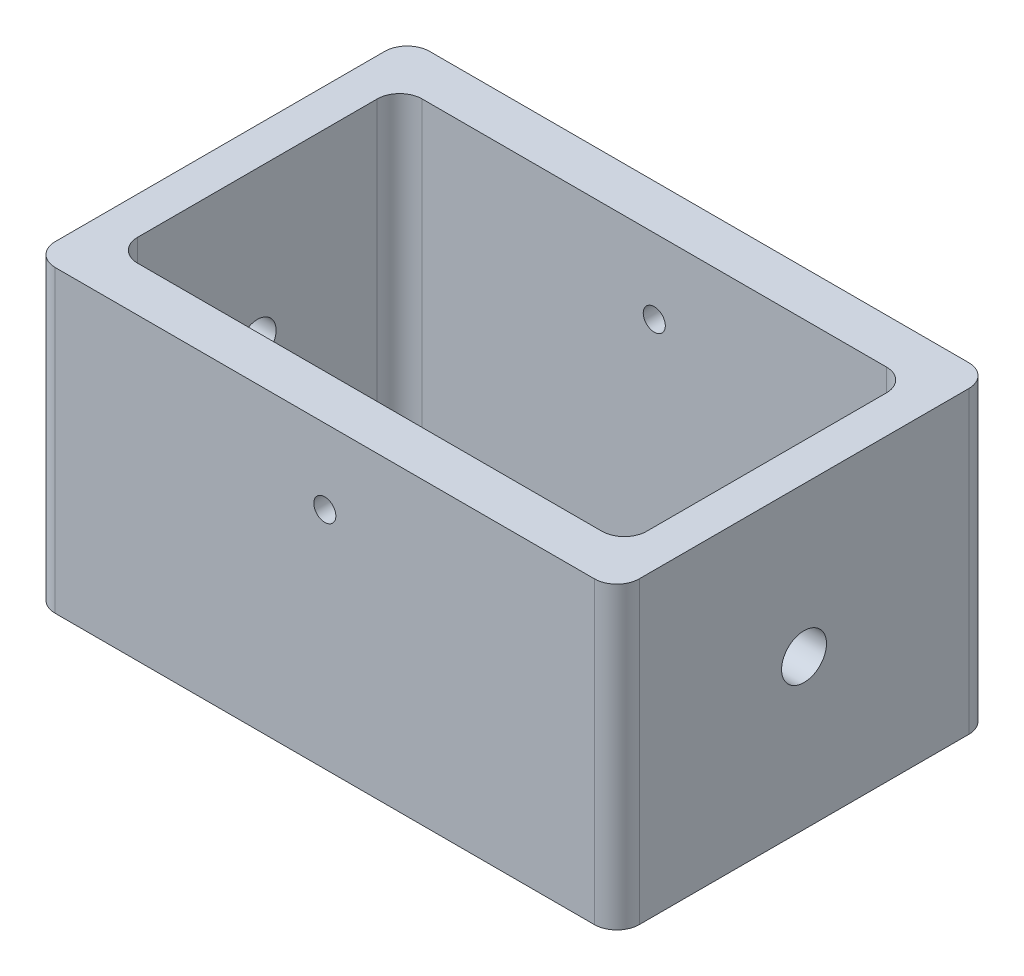
from build123d import *

# Parameters (mm, degrees)
SKETCH1_W           = 78
SKETCH1_H           = 50
SKETCH1_W_2         = 68
SKETCH1_H_2         = 38
BOSS_EXTRUDE1_DEPTH = 40
FILLET1_R           = 3
SKETCH2_R           = 3
CUT_EXTRUDE1_DEPTH  = 40
SKETCH3_R           = 2.5
CUT_EXTRUDE2_DEPTH  = 40
SKETCH4_R           = 1.475
CUT_EXTRUDE3_DEPTH  = 50


with BuildPart() as part:
    # Sketch1 → Boss-Extrude1 (new body)
    with BuildSketch(Plane(origin=(0, 0, 0), x_dir=(1, 0, 0), z_dir=(0, 1, 0))):
        with Locations((24.581369455, 5.203792641)):
            Rectangle(SKETCH1_W, SKETCH1_H)
        with Locations((24.581369455, 5.203792641)):
            Rectangle(SKETCH1_W_2, SKETCH1_H_2, mode=Mode.SUBTRACT)
    extrude(amount=BOSS_EXTRUDE1_DEPTH)

    # Fillet1
    fillet1_edges = [part.edges().sort_by_distance(p)[0] for p in [
        (58.581369455, 20, -24.203792641),
        (-9.418630545, 20, -24.203792641),
        (-9.418630545, 20, 13.796207359),
        (58.581369455, 20, 13.796207359),
        (-14.418630545, 20, 19.796207359),
        (-14.418630545, 20, -30.203792641),
        (63.581369455, 20, -30.203792641),
        (63.581369455, 20, 19.796207359),
    ]]
    fillet(fillet1_edges, radius=FILLET1_R)

    # Sketch2 → Cut-Extrude1 (cut)
    with BuildSketch(Plane(origin=(63.581369455, 0, 0), x_dir=(0, 0, -1), z_dir=(1, 0, 0))):
        with Locations((5.203792641, 20)):
            Circle(SKETCH2_R)
    extrude(amount=-CUT_EXTRUDE1_DEPTH, mode=Mode.SUBTRACT)

    # Sketch3 → Cut-Extrude2 (cut)
    with BuildSketch(Plane.ZY.offset(14.418630545)):
        with Locations((-5.203792641, 20)):
            Circle(SKETCH3_R)
    extrude(amount=-CUT_EXTRUDE2_DEPTH, mode=Mode.SUBTRACT)

    # Sketch4 → Cut-Extrude3 (cut)
    with BuildSketch(Plane(origin=(0, 0, -30.203792641), x_dir=(-1, 0, 0), z_dir=(0, 0, -1))):
        with Locations((-24.581369455, 30)):
            Circle(SKETCH4_R)
    extrude(amount=-CUT_EXTRUDE3_DEPTH, mode=Mode.SUBTRACT)


solid = part.part
